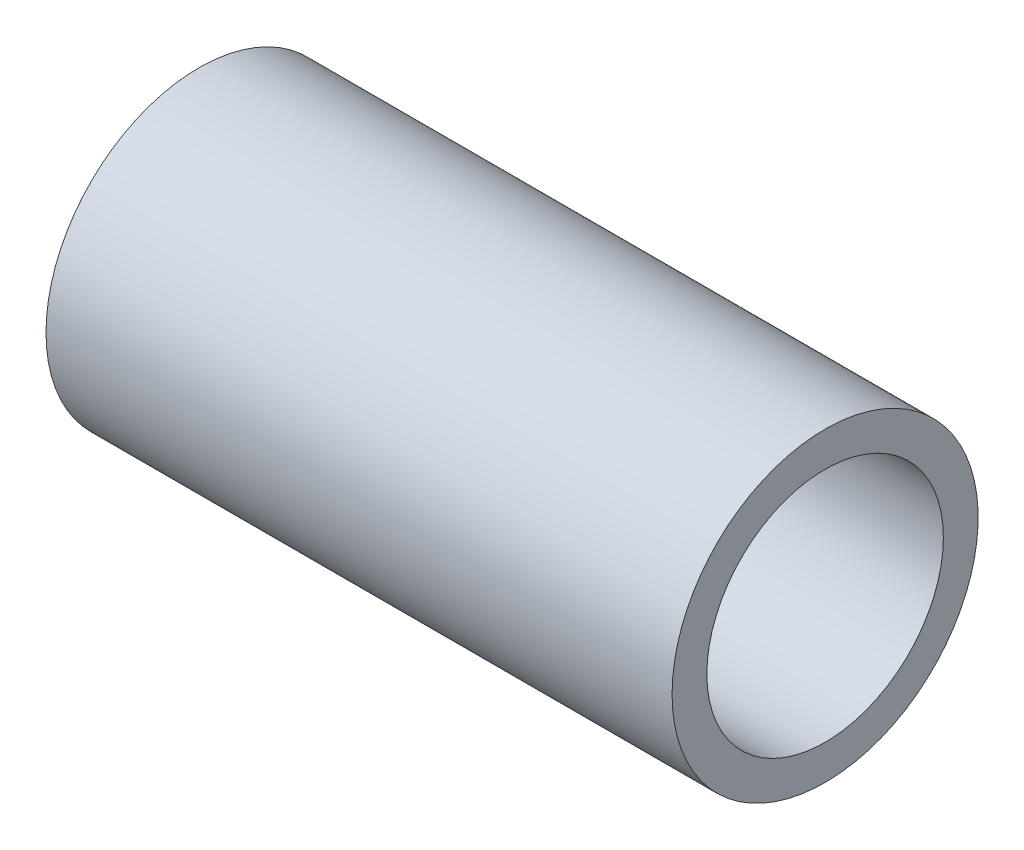
from build123d import *

# Parameters (mm, degrees)
SKETCH1_R           = 11
SKETCH1_R_2         = 8.5
BOSS_EXTRUDE1_DEPTH = 45


with BuildPart() as part:
    # Sketch1 → Boss-Extrude1 (new body)
    with BuildSketch(Plane(origin=(0, 0, 0), x_dir=(0, 0, -1), z_dir=(1, 0, 0))):
        with Locations(Location((0, 0, 0), (0, 0, 180))):
            Circle(SKETCH1_R)
        with Locations(Location((0, 0, 0), (0, 0, 180))):
            Circle(SKETCH1_R_2, mode=Mode.SUBTRACT)
    extrude(amount=BOSS_EXTRUDE1_DEPTH)


solid = part.part
